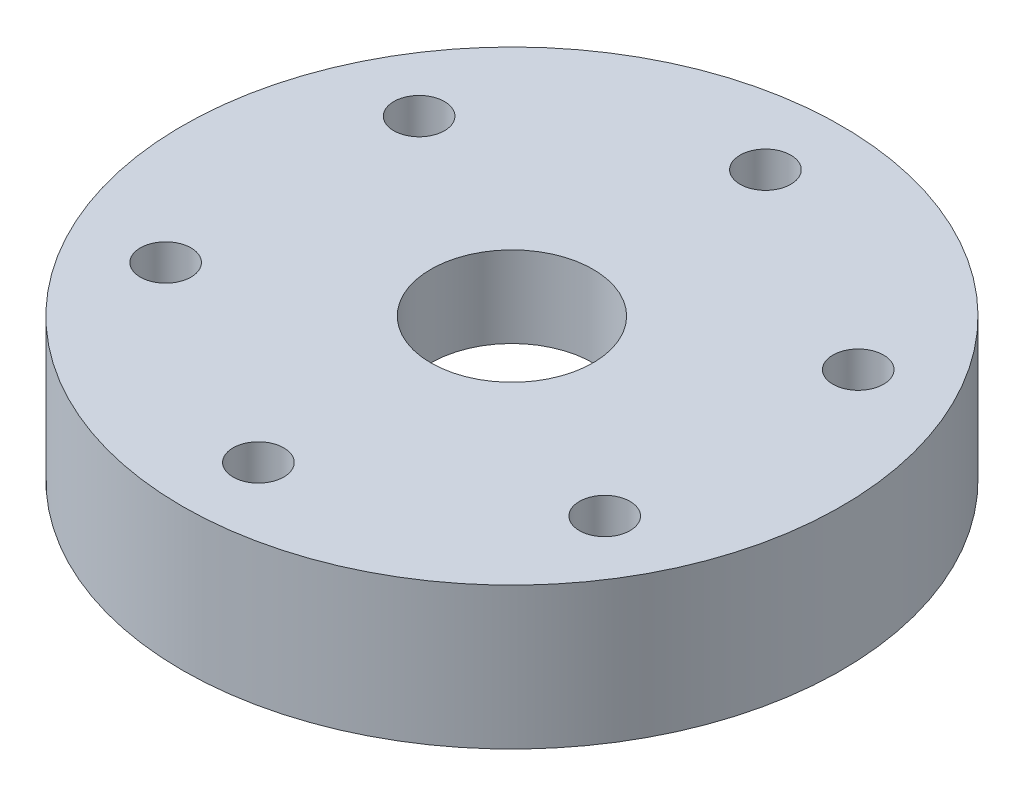
from build123d import *

# Parameters (mm, degrees)
SKETCH2_R          = 2.5
CUT_EXTRUDE1_DEPTH = 23


with BuildPart() as part:
    # Sketch1 → Revolve1 (revolve)
    with BuildSketch(Plane.XY, mode=Mode.PRIVATE) as revolve1_sk:
        Polygon((-8, 4.214497041), (-32.5, 4.214497041), (-32.5, -9.785502959), (-17.5, -9.785502959), (-17.5, -3.785502959), (-8, -3.785502959), align=None)
    revolve(revolve1_sk.sketch.rotate(Axis((0, 16.708579882, 0), (0, -1, 0)), 270), axis=Axis((0, 16.708579882, 0), (0, -1, 0)))

    # Sketch2 → Cut-Extrude1 (cut)
    with BuildSketch(Plane.XZ.offset(9.785502959)):
        with Locations(Location((0, 25, 0), (0, 0, 270))):
            Circle(SKETCH2_R)
        with Locations(Location((21.650635095, 12.5, 0), (0, 0, 270))):
            Circle(SKETCH2_R)
        with Locations(Location((21.650635095, -12.5, 0), (0, 0, 270))):
            Circle(SKETCH2_R)
        with Locations(Location((0, -25, 0), (0, 0, 270))):
            Circle(SKETCH2_R)
        with Locations(Location((-21.650635095, -12.5, 0), (0, 0, 270))):
            Circle(SKETCH2_R)
        with Locations(Location((-21.650635095, 12.5, 0), (0, 0, 270))):
            Circle(SKETCH2_R)
    extrude(amount=-CUT_EXTRUDE1_DEPTH, mode=Mode.SUBTRACT)


solid = part.part
